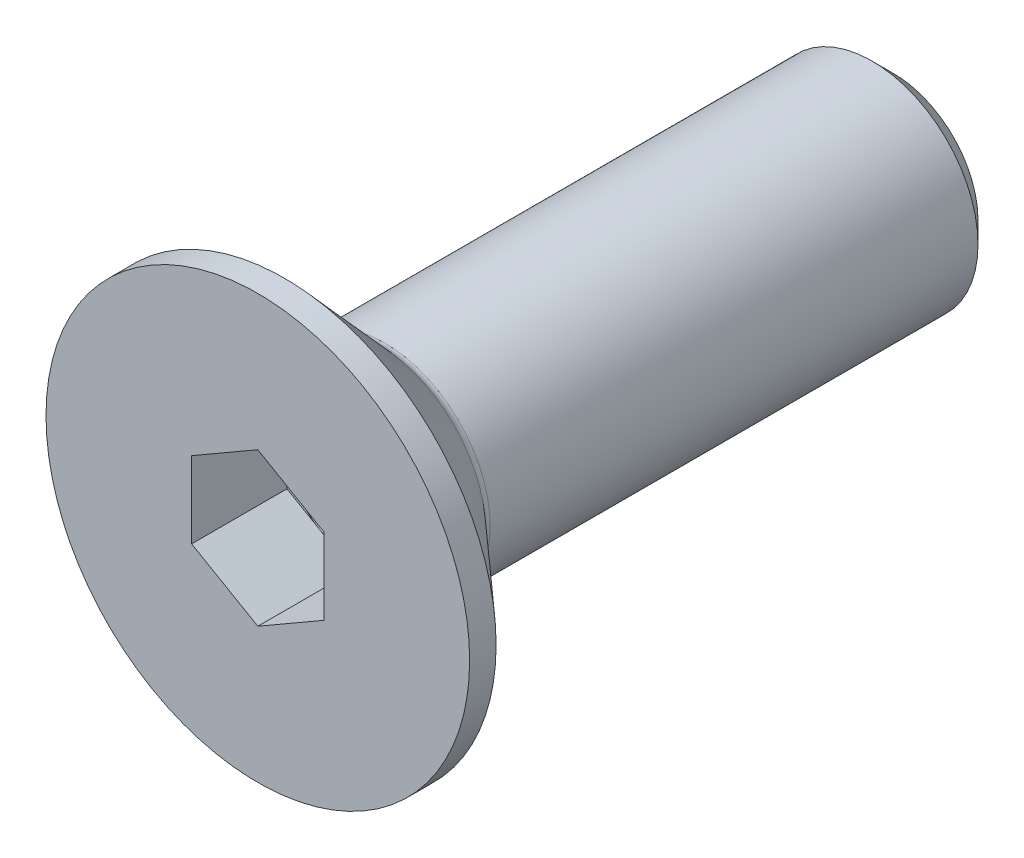
from build123d import *

# Parameters (mm, degrees)
CHANFRO1_SIZE         = 0.4
CORTE_EXTRUS_O1_DEPTH = 1.8
FILETE1_R             = 0.2


with BuildPart() as part:
    # Esboço4 → Revolução1 (revolve)
    with BuildSketch(Plane(origin=(0, 0, 0), x_dir=(0, 0, -1), z_dir=(1, 0, 0)), mode=Mode.PRIVATE) as revolu_o1_sk:
        Polygon((0, 4), (0, 0), (12, 0), (12, 2), (2.3, 2), (0.5, 4), align=None)
    revolve(revolu_o1_sk.sketch.rotate(Axis((0, 0, 0), (0, 0, -1)), 90), axis=Axis((0, 0, 0), (0, 0, -1)))

    # Chanfro1
    chanfro1_edges = [part.edges().sort_by_distance(p)[0] for p in [
        (-2, 0, -12),
    ]]
    chamfer(chanfro1_edges, length=CHANFRO1_SIZE)

    # Esboço5 → Corte-extrusão1 (cut)
    with BuildSketch(Plane.XY):
        Polygon((-1.25, -0.721687836), (0, -1.443375673), (1.25, -0.721687836), (1.25, 0.721687836), (0, 1.443375673), (-1.25, 0.721687836), align=None)
    extrude(amount=-CORTE_EXTRUS_O1_DEPTH, mode=Mode.SUBTRACT)

    # Corte-extrusão2 cone 1 section (through the dimple's axis) → Corte-extrusão2 (revolve, cut)
    with BuildSketch(Plane(origin=(0, 0, -1.8), x_dir=(0, -1, 0), z_dir=(1, 0, 0))):
        Polygon((0, 0), (1.25, 0), (0, 0.479830044), align=None)
    revolve(axis=Axis((0, 0, -1.8), (0, 0, -1)), mode=Mode.SUBTRACT)

    # Filete1
    filete1_edges = [part.edges().sort_by_distance(p)[0] for p in [
        (-2, 0, -2.3),
    ]]
    fillet(filete1_edges, radius=FILETE1_R)


solid = part.part
